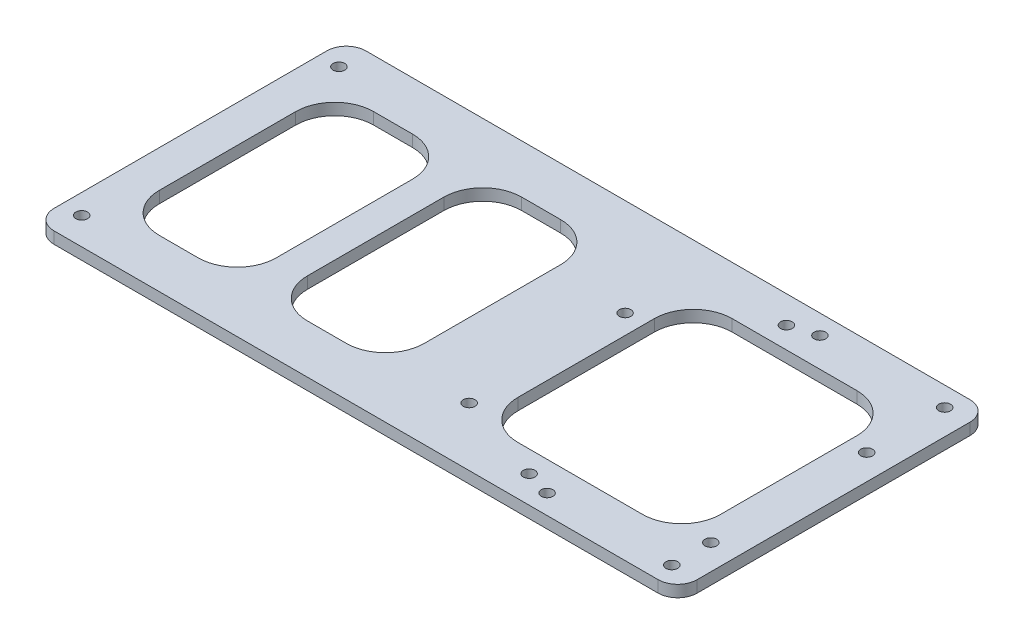
from build123d import *

# Parameters (mm, degrees)
SKETCH_1_W      = 75
SKETCH_1_H      = 70
SKETCH_1_R      = 1.5
SKETCH_1_W_2    = 52
SKETCH_1_H_2    = 55
SKETCH_1_W_3    = 90
SKETCH_1_W_4    = 30
EXTRUDE_1_DEPTH = 3
FILLET_1_R      = 10
FILLET_2_R      = 5
FILLET_3_R      = 10


with BuildPart() as part:
    # 草图1 → 凸台-拉伸1 (new body)
    # profile 1 of 3: a face of its own
    with BuildSketch(Plane(origin=(0, 0, 0), x_dir=(1, 0, 0), z_dir=(0, 1, 0))):
        Rectangle(SKETCH_1_W, SKETCH_1_H)
        with Locations(Location((-7.6, -28, 0), (0, 0, 270))):
            Circle(SKETCH_1_R, mode=Mode.SUBTRACT)
        with Locations(Location((-31, -20, 0), (0, 0, 270))):
            Circle(SKETCH_1_R, mode=Mode.SUBTRACT)
        with Locations(Location((-1, -30, 0), (0, 0, 270))):
            Circle(SKETCH_1_R, mode=Mode.SUBTRACT)
        with Locations(Location((31, -30, 0), (0, 0, 270))):
            Circle(SKETCH_1_R, mode=Mode.SUBTRACT)
        with Locations(Location((31, -20, 0), (0, 0, 270))):
            Circle(SKETCH_1_R, mode=Mode.SUBTRACT)
        with Locations((0, 5)):
            Rectangle(SKETCH_1_W_2, SKETCH_1_H_2, mode=Mode.SUBTRACT)
        with Locations(Location((-31, 20, 0), (0, 0, 270))):
            Circle(SKETCH_1_R, mode=Mode.SUBTRACT)
        with Locations(Location((31, 20, 0), (0, 0, 270))):
            Circle(SKETCH_1_R, mode=Mode.SUBTRACT)
    # profile 2 of 3: a face of its own
    with BuildSketch(Plane(origin=(0, 0, 0), x_dir=(1, 0, 0), z_dir=(0, 1, 0))):
        with Locations((-82.5, 0)):
            Rectangle(SKETCH_1_W_3, SKETCH_1_H)
        with Locations(Location((-122.4, -28, 0), (0, 0, 270))):
            Circle(SKETCH_1_R, mode=Mode.SUBTRACT)
        with Locations((-65, 5)):
            Rectangle(SKETCH_1_W_4, SKETCH_1_H_2, mode=Mode.SUBTRACT)
        with Locations((-103, 5)):
            Rectangle(SKETCH_1_W_4, SKETCH_1_H_2, mode=Mode.SUBTRACT)
    # profile 3 of 3: a face of its own
    with BuildSketch(Plane(origin=(0, 0, 0), x_dir=(1, 0, 0), z_dir=(0, 1, 0))):
        Polygon((-127.5, 35), (-37.5, 35), (37.5, 35), (37.5, 45), (-127.5, 45), align=None)
        with Locations(Location((-122.4, 38, 0), (0, 0, 270))):
            Circle(SKETCH_1_R, mode=Mode.SUBTRACT)
        with Locations(Location((-7.6, 38, 0), (0, 0, 270))):
            Circle(SKETCH_1_R, mode=Mode.SUBTRACT)
        with Locations(Location((-1, 40, 0), (0, 0, 270))):
            Circle(SKETCH_1_R, mode=Mode.SUBTRACT)
        with Locations(Location((31, 40, 0), (0, 0, 270))):
            Circle(SKETCH_1_R, mode=Mode.SUBTRACT)
    extrude(amount=EXTRUDE_1_DEPTH)

    # 圆角1
    fillet_1_edges = [part.edges().sort_by_distance(p)[0] for p in [
        (-88, 1.5, -32.5),
        (-118, 1.5, -32.5),
        (-118, 1.5, 22.5),
        (-88, 1.5, 22.5),
        (-50, 1.5, -32.5),
        (-80, 1.5, -32.5),
        (-80, 1.5, 22.5),
        (-50, 1.5, 22.5),
    ]]
    fillet(fillet_1_edges, radius=FILLET_1_R)

    # 圆角2
    fillet_2_edges = [part.edges().sort_by_distance(p)[0] for p in [
        (-127.5, 1.5, -45),
        (37.5, 1.5, -45),
        (37.5, 1.5, 35),
        (-127.5, 1.5, 35),
    ]]
    fillet(fillet_2_edges, radius=FILLET_2_R)

    # 圆角3
    fillet_3_edges = [part.edges().sort_by_distance(p)[0] for p in [
        (26, 1.5, -32.5),
        (-26, 1.5, -32.5),
        (-26, 1.5, 22.5),
        (26, 1.5, 22.5),
    ]]
    fillet(fillet_3_edges, radius=FILLET_3_R)


solid = part.part
